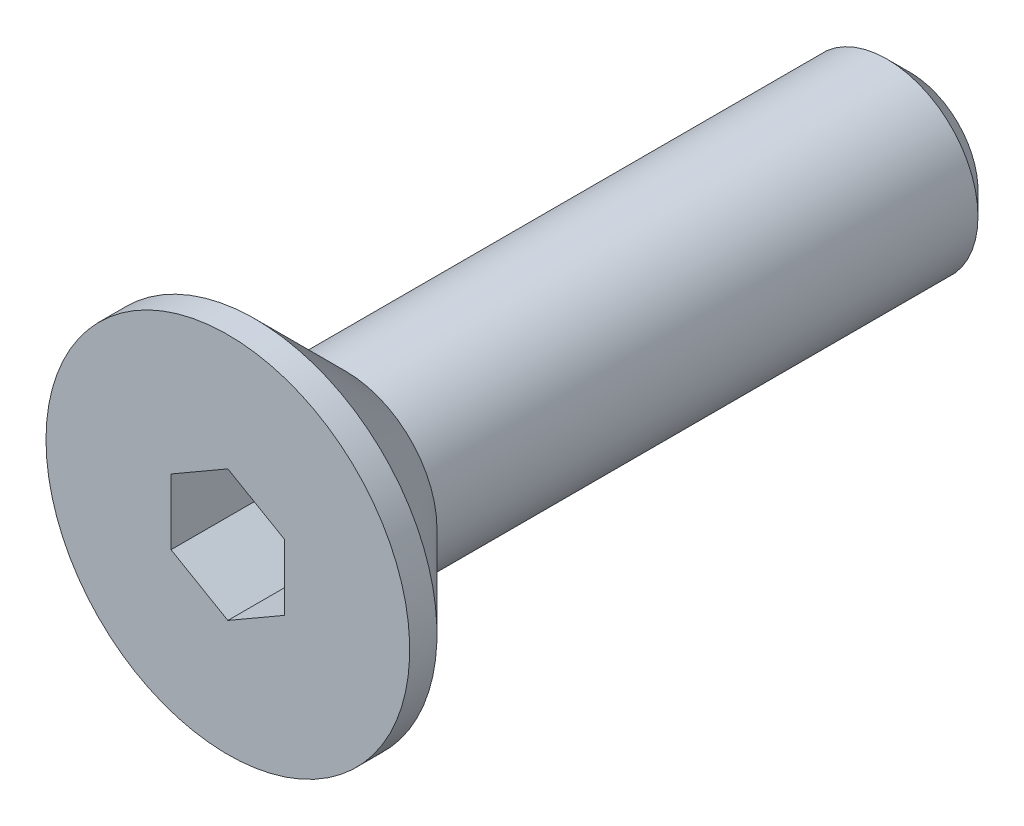
from build123d import *

# Parameters (mm, degrees)
CHAMFER_1_SIZE      = 0.5
CUT_EXTRUDE_1_DEPTH = 2.5


with BuildPart() as part:
    # 草图1 → 旋转1 (revolve)
    with BuildSketch(Plane(origin=(0, 0, 0), x_dir=(0, 0, -1), z_dir=(1, 0, 0)), mode=Mode.PRIVATE) as revolve_1_sk:
        Polygon((-7.5, 0), (-7.5, 4), (-6.9, 4), (-4.9, 2), (7.5, 2), (7.5, 0), align=None)
    revolve(revolve_1_sk.sketch.rotate(Axis((0, 0, -7.5), (0, 0, 1)), 90), axis=Axis((0, 0, -7.5), (0, 0, 1)))

    # 倒角1
    chamfer_1_edges = [part.edges().sort_by_distance(p)[0] for p in [
        (2, 0, -7.5),
    ]]
    chamfer(chamfer_1_edges, length=CHAMFER_1_SIZE)

    # 草图2 → 切除-拉伸1 (cut)
    with BuildSketch(Plane.XY.offset(7.5)):
        Polygon((0, 1.443375673), (-1.25, 0.721687836), (-1.25, -0.721687836), (0, -1.443375673), (1.25, -0.721687836), (1.25, 0.721687836), align=None)
    extrude(amount=-CUT_EXTRUDE_1_DEPTH, mode=Mode.SUBTRACT)


solid = part.part
